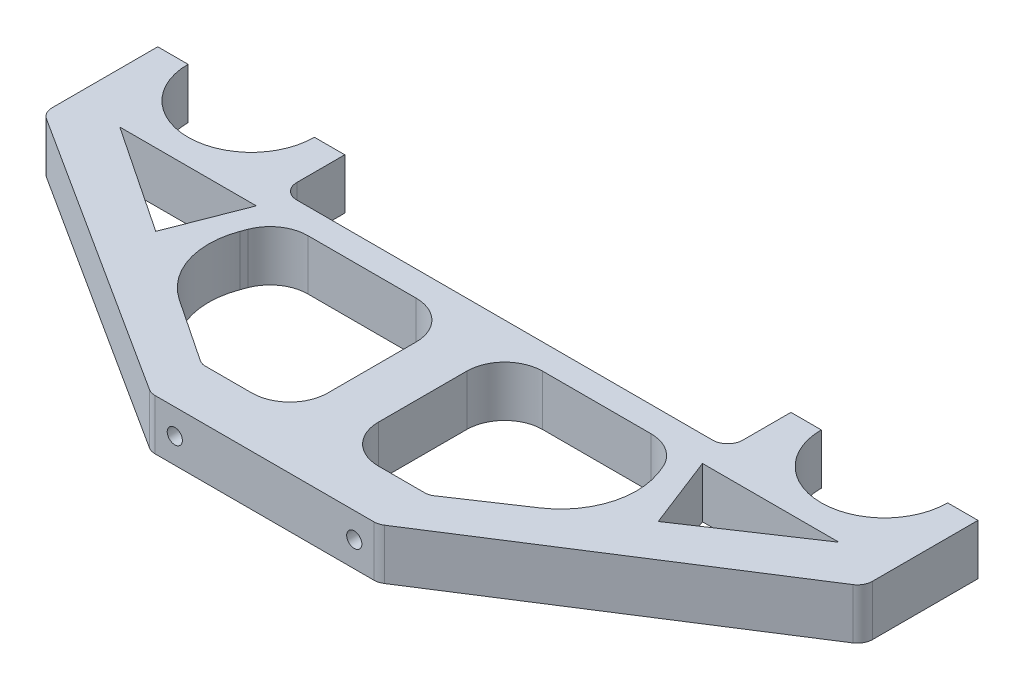
from build123d import *

# Parameters (mm, degrees)
BOSS_EXTRUDE1_DEPTH = 10
CUT_EXTRUDE5_REACH  = 103.397
SKETCH9_R           = 1.5
FILLET13_R          = 7.5
FILLET14_R          = 15
FILLET16_R          = 7.5
FILLET18_R          = 7.5
FILLET19_R          = 7.5
FILLET22_R          = 3
FILLET23_R          = 3
FILLET24_R          = 15
FILLET28_R          = 3
FILLET29_R          = 3
FILLET30_R          = 3
FILLET31_R          = 3
FILLET32_R          = 7.5
FILLET34_R          = 7.5
FILLET35_R          = 2.5
FILLET36_R          = 2.5


with BuildPart() as part:
    # Sketch1 → Boss-Extrude1 (new body)
    with BuildSketch(Plane(origin=(0, 0, 0), x_dir=(1, 0, 0), z_dir=(0, 1, 0))):
        with BuildLine():
            Line((0, -12.5), (0, -60))
            Line((0, -60), (22.5, -60))
            Line((22.5, -60), (81.125, -22.5))
            Line((81.125, -22.5), (81.125, 0))
            Line((81.125, 0), (75.125, 0))
            ThreePointArc((75.125, 0), (62.625, -12.5), (50.125, 0))
            Line((50.125, 0), (44.125, 0))
            Line((44.125, 0), (44.125, -12.5))
            Line((44.125, -12.5), (0, -12.5))
        make_face()
        Polygon((39.125, -17.5), (45.538841531, -34.595428821), (22.483333333, -50), (5, -50), (5, -17.5), align=None, mode=Mode.SUBTRACT)
        Polygon((71.125, -17.5), (49.69624181, -31.817655806), (44.125, -17.5), align=None, mode=Mode.SUBTRACT)
    boss_extrude1 = extrude(amount=BOSS_EXTRUDE1_DEPTH)

    # Mirror1: Boss-Extrude1 across plane
    add(boss_extrude1.mirror(Plane(origin=(0, 10, 0), x_dir=(0, 0, 1), z_dir=(-1, 0, 0))))

    # Sketch9 → Cut-Extrude5 (cut, up to next)
    with BuildSketch(Plane.XY.offset(60), mode=Mode.PRIVATE) as cut_extrude5_sk1:
        with Locations((-17.75, 5)):
            Circle(SKETCH9_R)
    cut_extrude5_tool1 = extrude(cut_extrude5_sk1.sketch, amount=-CUT_EXTRUDE5_REACH, mode=Mode.PRIVATE) & part.part
    cut_extrude5 = cut_extrude5_tool1.solids().sort_by_distance((-17.75, 5, 60))[0]
    add(cut_extrude5, mode=Mode.SUBTRACT)

    # Mirror2: Cut-Extrude5 across plane
    add(cut_extrude5.mirror(Plane(origin=(0, 0, 0), x_dir=(0, 0, 1), z_dir=(1, 0, 0))), mode=Mode.SUBTRACT)

    # Fillet13
    fillet13_edges = [part.edges().sort_by_distance(p)[0] for p in [
        (39.125, 5, 17.5),
    ]]
    fillet(fillet13_edges, radius=FILLET13_R)

    # Fillet14
    fillet14_edges = [part.edges().sort_by_distance(p)[0] for p in [
        (45.538841531, 5, 34.595428821),
    ]]
    fillet(fillet14_edges, radius=FILLET14_R)

    # Fillet16
    fillet16_edges = [part.edges().sort_by_distance(p)[0] for p in [
        (5, 5, 17.5),
    ]]
    fillet(fillet16_edges, radius=FILLET16_R)

    # Fillet18
    fillet18_edges = [part.edges().sort_by_distance(p)[0] for p in [
        (-5, 5, 17.5),
    ]]
    fillet(fillet18_edges, radius=FILLET18_R)

    # Fillet19
    fillet19_edges = [part.edges().sort_by_distance(p)[0] for p in [
        (-39.125, 5, 17.5),
    ]]
    fillet(fillet19_edges, radius=FILLET19_R)

    # Fillet22
    fillet22_edges = [part.edges().sort_by_distance(p)[0] for p in [
        (44.125, 5, 12.5),
    ]]
    fillet(fillet22_edges, radius=FILLET22_R)

    # Fillet23
    fillet23_edges = [part.edges().sort_by_distance(p)[0] for p in [
        (-44.125, 5, 12.5),
    ]]
    fillet(fillet23_edges, radius=FILLET23_R)

    # Fillet24
    fillet24_edges = [part.edges().sort_by_distance(p)[0] for p in [
        (-45.538841531, 5, 34.595428821),
    ]]
    fillet(fillet24_edges, radius=FILLET24_R)

    # Fillet28
    fillet28_edges = [part.edges().sort_by_distance(p)[0] for p in [
        (22.5, 5, 60),
    ]]
    fillet(fillet28_edges, radius=FILLET28_R)

    # Fillet29
    fillet29_edges = [part.edges().sort_by_distance(p)[0] for p in [
        (-22.5, 5, 60),
    ]]
    fillet(fillet29_edges, radius=FILLET29_R)

    # Fillet30
    fillet30_edges = [part.edges().sort_by_distance(p)[0] for p in [
        (81.125, 5, 22.5),
    ]]
    fillet(fillet30_edges, radius=FILLET30_R)

    # Fillet31
    fillet31_edges = [part.edges().sort_by_distance(p)[0] for p in [
        (-81.125, 5, 22.5),
    ]]
    fillet(fillet31_edges, radius=FILLET31_R)

    # Fillet32
    fillet32_edges = [part.edges().sort_by_distance(p)[0] for p in [
        (-5, 5, 50),
    ]]
    fillet(fillet32_edges, radius=FILLET32_R)

    # Fillet34
    fillet34_edges = [part.edges().sort_by_distance(p)[0] for p in [
        (5, 5, 50),
    ]]
    fillet(fillet34_edges, radius=FILLET34_R)

    # Fillet35
    fillet35_edges = [part.edges().sort_by_distance(p)[0] for p in [
        (-22.483333333, 5, 50),
    ]]
    fillet(fillet35_edges, radius=FILLET35_R)

    # Fillet36
    fillet36_edges = [part.edges().sort_by_distance(p)[0] for p in [
        (22.483333333, 5, 50),
    ]]
    fillet(fillet36_edges, radius=FILLET36_R)


solid = part.part
